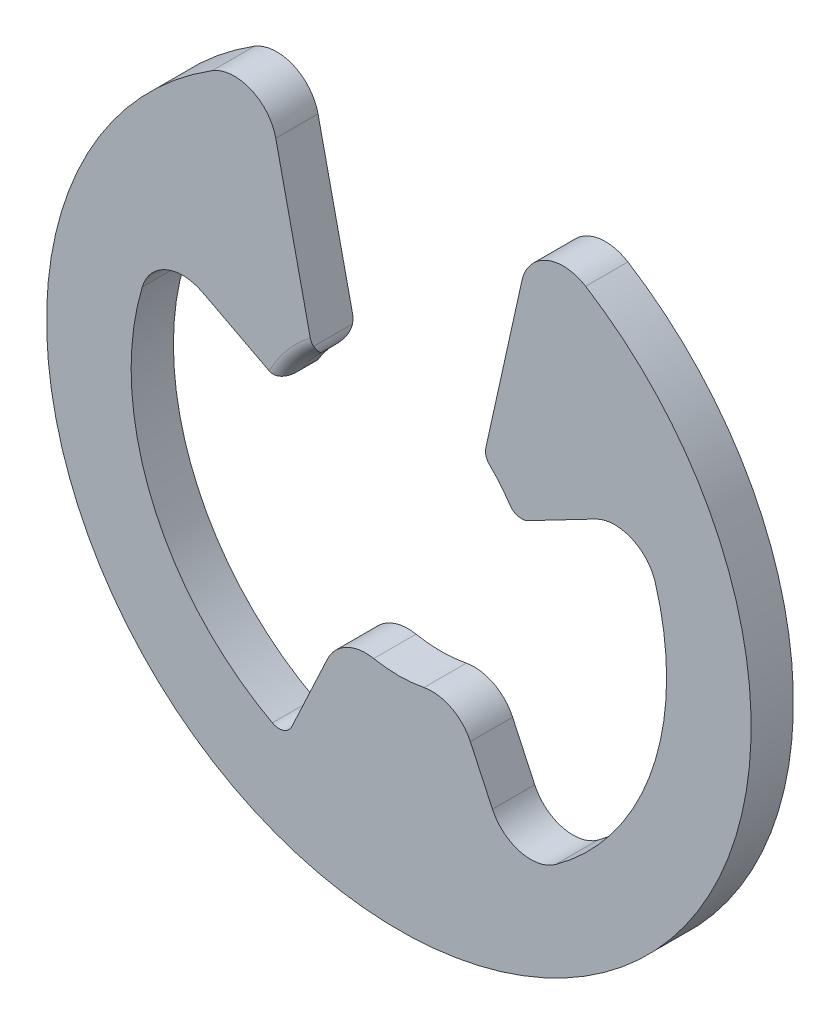
from build123d import *
from OCP.BRepFilletAPI import BRepFilletAPI_MakeFillet

# Parameters (mm, degrees)
SKETCH1_R               = 3.175
SKETCH1_R_2             = 1.18999
BOSS_EXTRUDE1_DEPTH     = 0.1905
CUT_EXTRUDE1_DEPTH      = 5.50626353
CUT_EXTRUDE2_DEPTH      = 5.50626353
CUT_EXTRUDE2_DEPTH_BACK = 5.50626353
FILLET1_R1              = 0.127
FILLET1_R2              = 0.381


with BuildPart() as part:
    # Sketch1 → Boss-Extrude1 (new, symmetric)
    with BuildSketch(Plane.XY):
        with Locations(Location((0, 0, 0), (0, 0, 180))):
            Circle(SKETCH1_R)
        with Locations(Location((0, 0, 0), (0, 0, 180))):
            Circle(SKETCH1_R_2, mode=Mode.SUBTRACT)
    extrude(amount=BOSS_EXTRUDE1_DEPTH, both=True)

    # Sketch2 → Cut-Extrude1 (cut, through all)
    with BuildSketch(Plane.XY.offset(0.1905)):
        Polygon((-0.635, 0.3107001), (0.635, 0.3107001), (1.27, 3.175), (-1.27, 3.175), align=None)
    extrude(amount=-CUT_EXTRUDE1_DEPTH, mode=Mode.SUBTRACT)

    # Sketch3 → Cut-Extrude2 (cut, two sides: drawn at the far end of the back side and taken through both)
    with BuildSketch(Plane.XY.offset(0.1905).offset(-CUT_EXTRUDE2_DEPTH_BACK)):
        with BuildLine():
            Line((-1.05664, 0.547346426), (-2.141464207, 1.112070164))
            ThreePointArc((-2.141464207, 1.112070164), (-2.284557926, -0.77676514), (-1.01978636, -2.186916729))
            Line((-1.01978636, -2.186916729), (-0.50292, -1.078493242))
            ThreePointArc((-0.50292, -1.078493242), (-1.12645262, -0.383641362), (-1.05664, 0.547346426))
        make_face()
        with BuildLine():
            Line((0.50292, -1.078493242), (1.01978636, -2.186916729))
            ThreePointArc((1.01978636, -2.186916729), (2.284557926, -0.77676514), (2.141464207, 1.112070164))
            Line((2.141464207, 1.112070164), (1.05664, 0.547346426))
            ThreePointArc((1.05664, 0.547346426), (1.12645262, -0.383641362), (0.50292, -1.078493242))
        make_face()
    extrude(amount=CUT_EXTRUDE2_DEPTH + CUT_EXTRUDE2_DEPTH_BACK, mode=Mode.SUBTRACT)

    # Fillet1: one fillet with a radius per group of edges: ONE call of the kernel's fillet builder (fillet() takes one radius for all edges)
    fillet1_edges_1 = [part.edges().sort_by_distance(p)[0] for p in [
        (-0.929941204, 0.742486065, 0.1905),
        (-0.929941204, 0.742486065, -0.1905),
        (-0.76769373, 0.909242837, 0),
        (0.76769373, 0.909242837, 0),
        (-1.05664, 0.547346426, 0),
        (-1.01978636, -2.186916729, 0),
        (1.05664, 0.547346426, 0),
    ]]
    fillet1_edges_2 = [part.edges().sort_by_distance(p)[0] for p in [
        (1.216302436, 2.932785942, 0),
        (-1.216302436, 2.932785942, 0),
        (-2.141464207, 1.112070164, 0),
        (-0.50292, -1.078493242, 0),
        (1.01978636, -2.186916729, 0),
        (0.50292, -1.078493242, 0),
        (2.141464207, 1.112070164, 0),
    ]]
    fillet1 = BRepFilletAPI_MakeFillet(part.part.solid().wrapped)
    for e in fillet1_edges_1:
        fillet1.Add(FILLET1_R1, e.wrapped)
    for e in fillet1_edges_2:
        fillet1.Add(FILLET1_R2, e.wrapped)
    add(Compound.cast(fillet1.Shape()), mode=Mode.REPLACE)


solid = part.part
